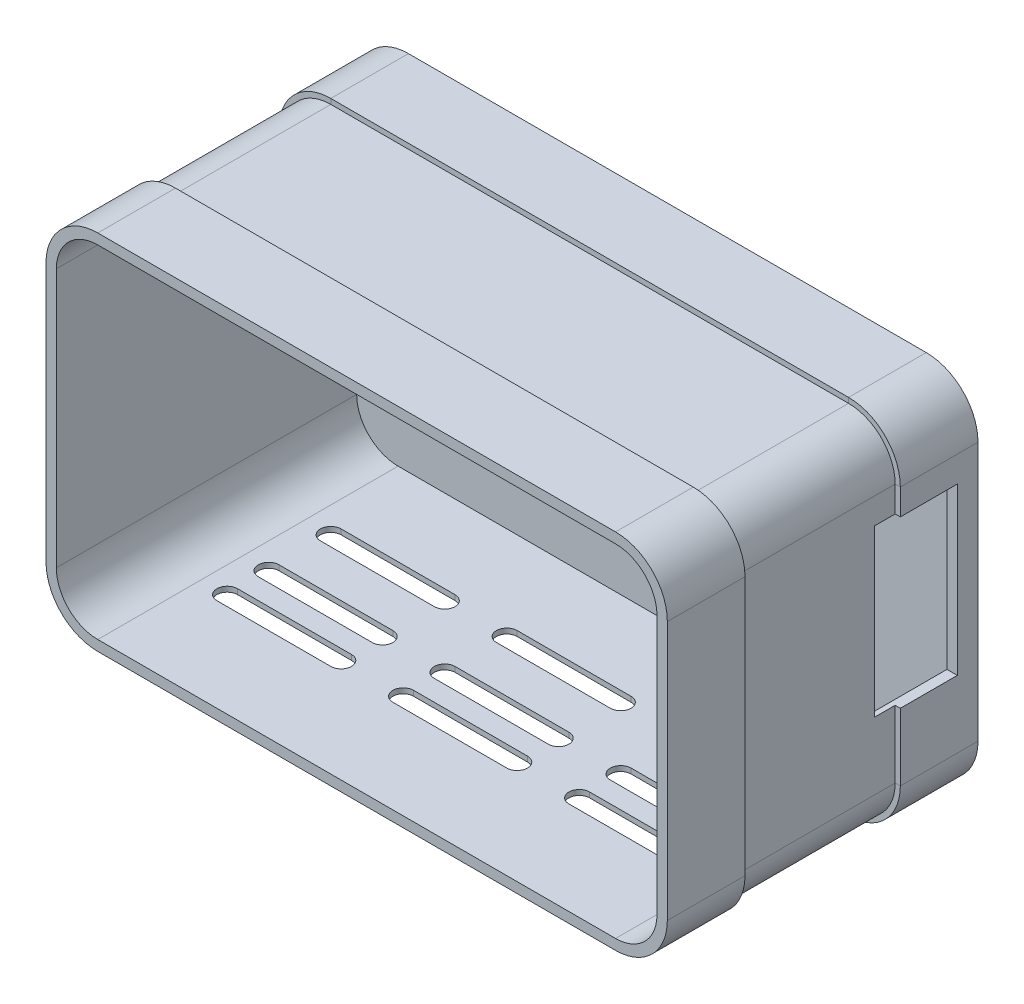
from build123d import *

# Parameters (mm, degrees)
BOSS_EXTRU_2_DEPTH      = 30
COQUE2_T                = -2
ESQUISSE11_W            = 2
ESQUISSE11_H            = 30
ENL_V_MAT_EXTRU_2_DEPTH = 5
ESQUISSE17_W            = 15
ESQUISSE17_H            = 32
ENL_V_MAT_EXTRU_3_DEPTH = 10


with BuildPart() as part:
    # Esquisse5 → Boss.-Extru.2 (new, symmetric)
    with BuildSketch(Plane.XY):
        with BuildLine():
            Line((-50, -35), (50, -35))
            ThreePointArc((50, -35), (57.071067812, -32.071067812), (60, -25))
            Line((60, -25), (60, 25))
            ThreePointArc((60, 25), (57.071067812, 32.071067812), (50, 35))
            Line((50, 35), (-50, 35))
            ThreePointArc((-50, 35), (-57.071067812, 32.071067812), (-60, 25))
            Line((-60, 25), (-60, -25))
            ThreePointArc((-60, -25), (-57.071067812, -32.071067812), (-50, -35))
        make_face()
    extrude(amount=BOSS_EXTRU_2_DEPTH, both=True)

    # Coque2
    coque2_openings = [part.faces().sort_by_distance(p)[0] for p in [
        (0, 0, 30),
    ]]
    offset(amount=COQUE2_T, openings=coque2_openings, kind=Kind.INTERSECTION)

    # Enlèvement de matière-Balayage11: sweep along a path in Esquisse5<5>
    with BuildLine(Plane.XY) as enl_vement_de_mati_re_balayage11_path:
        Line((-50, -35), (50, -35))
        ThreePointArc((50, -35), (57.071067812, -32.071067812), (60, -25))
        Line((60, -25), (60, 25))
        ThreePointArc((60, 25), (57.071067812, 32.071067812), (50, 35))
        Line((50, 35), (-50, 35))
        ThreePointArc((-50, 35), (-57.071067812, 32.071067812), (-60, 25))
        Line((-60, 25), (-60, -25))
        ThreePointArc((-60, -25), (-57.071067812, -32.071067812), (-50, -35))
    # Esquisse11 → Enlèvement de matière-Balayage11 (sweep, cut)
    with BuildSketch(Plane(origin=(0, 0, 0), x_dir=(1, 0, 0), z_dir=(0, 1, 0))):
        with Locations((-60, 0)):
            Rectangle(ESQUISSE11_W, ESQUISSE11_H)
    sweep(path=enl_vement_de_mati_re_balayage11_path.line, mode=Mode.SUBTRACT)

    # Esquisse16 → Enlèv. mat.-Extru.2 (cut, symmetric)
    with BuildSketch(Plane.XZ.offset(34)):
        with BuildLine():
            Line((22.996916051, 12), (44.996916051, 12))
            ThreePointArc((44.996916051, 12), (46.996916051, 10), (44.996916051, 8))
            Line((44.996916051, 8), (22.996916051, 8))
            ThreePointArc((22.996916051, 8), (20.996916051, 10), (22.996916051, 12))
        make_face()
        with BuildLine():
            Line((-11.003083949, 12), (10.996916051, 12))
            ThreePointArc((10.996916051, 12), (12.996916051, 10), (10.996916051, 8))
            Line((10.996916051, 8), (-11.003083949, 8))
            ThreePointArc((-11.003083949, 8), (-13.003083949, 10), (-11.003083949, 12))
        make_face()
        with BuildLine():
            Line((-45, 12), (-23, 12))
            ThreePointArc((-23, 12), (-21, 10), (-23, 8))
            Line((-23, 8), (-45, 8))
            ThreePointArc((-45, 8), (-47, 10), (-45, 12))
        make_face()
        with BuildLine():
            Line((22.996916051, 0), (44.996916051, 0))
            ThreePointArc((44.996916051, 0), (46.996916051, 2), (44.996916051, 4))
            Line((44.996916051, 4), (22.996916051, 4))
            ThreePointArc((22.996916051, 4), (20.996916051, 2), (22.996916051, 0))
        make_face()
        with BuildLine():
            Line((-11.003083949, 0), (10.996916051, 0))
            ThreePointArc((10.996916051, 0), (12.996916051, 2), (10.996916051, 4))
            Line((10.996916051, 4), (-11.003083949, 4))
            ThreePointArc((-11.003083949, 4), (-13.003083949, 2), (-11.003083949, 0))
        make_face()
        with BuildLine():
            Line((-45, 0), (-23, 0))
            ThreePointArc((-23, 0), (-21, 2), (-23, 4))
            Line((-23, 4), (-45, 4))
            ThreePointArc((-45, 4), (-47, 2), (-45, 0))
        make_face()
        with BuildLine():
            Line((-45, -8), (-23, -8))
            ThreePointArc((-23, -8), (-21, -10), (-23, -12))
            Line((-23, -12), (-45, -12))
            ThreePointArc((-45, -12), (-47, -10), (-45, -8))
        make_face()
        with BuildLine():
            Line((-11.003083949, -8), (10.996916051, -8))
            ThreePointArc((10.996916051, -8), (12.996916051, -10), (10.996916051, -12))
            Line((10.996916051, -12), (-11.003083949, -12))
            ThreePointArc((-11.003083949, -12), (-13.003083949, -10), (-11.003083949, -8))
        make_face()
        with BuildLine():
            Line((22.996916051, -8), (44.996916051, -8))
            ThreePointArc((44.996916051, -8), (46.996916051, -10), (44.996916051, -12))
            Line((44.996916051, -12), (22.996916051, -12))
            ThreePointArc((22.996916051, -12), (20.996916051, -10), (22.996916051, -8))
        make_face()
    extrude(amount=ENL_V_MAT_EXTRU_2_DEPTH, both=True, mode=Mode.SUBTRACT)

    # Esquisse17 → Enlèv. mat.-Extru.3 (cut)
    with BuildSketch(Plane(origin=(60, 0, 0), x_dir=(0, 0, -1), z_dir=(1, 0, 0))):
        with Locations((18.5, 4)):
            Rectangle(ESQUISSE17_W, ESQUISSE17_H)
    extrude(amount=-ENL_V_MAT_EXTRU_3_DEPTH, mode=Mode.SUBTRACT)


solid = part.part
